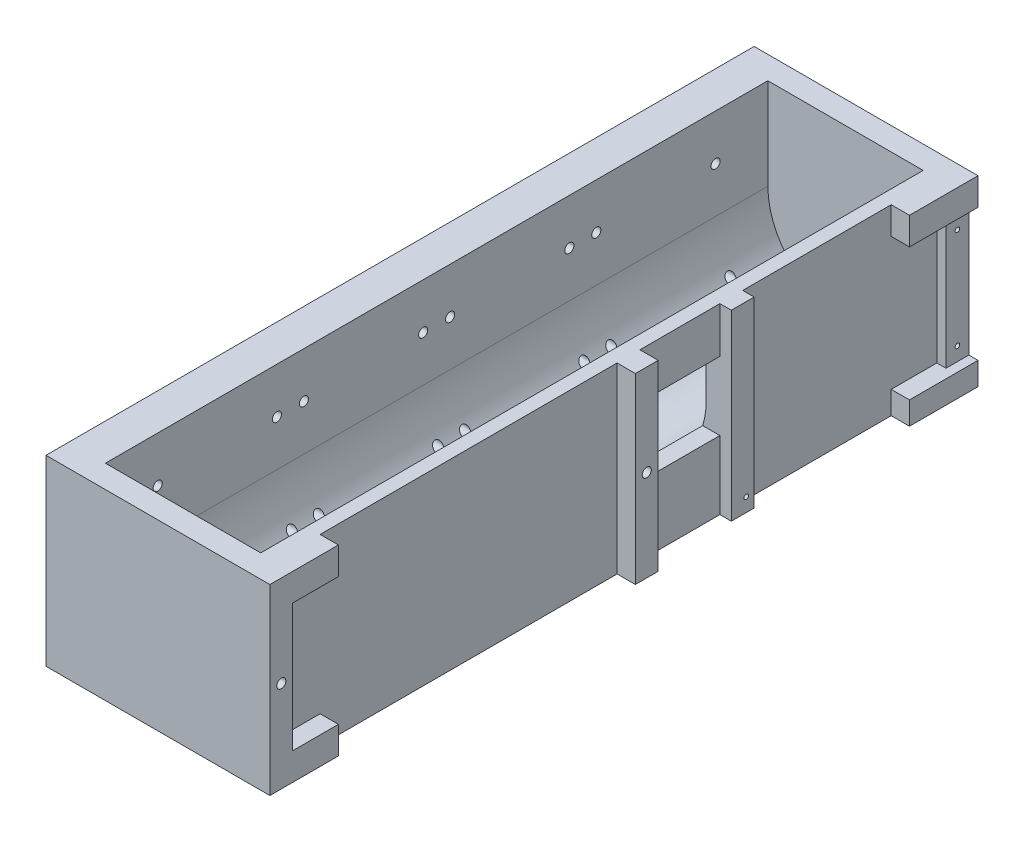
from build123d import *

# Parameters (mm, degrees)
SKETCH1_W            = 40
SKETCH1_H            = 40
BOSS_EXTRUDE1_DEPTH  = 155
SKETCH2_W            = 34
SKETCH2_H            = 145
CUT_EXTRUDE1_DEPTH   = 20
SKETCH3_R            = 17
CUT_EXTRUDE2_DEPTH   = 145
SKETCH4_W            = 155
SKETCH4_H            = 40
BOSS_EXTRUDE2_DEPTH  = 5
SKETCH5_R            = 1
CUT_EXTRUDE3_DEPTH   = 13
SKETCH6_W            = 5
SKETCH6_H            = 40
BOSS_EXTRUDE3_DEPTH  = 4
SKETCH7_W            = 5
SKETCH7_H            = 40
BOSS_EXTRUDE4_DEPTH  = 4
SKETCH8_W            = 5
SKETCH8_H            = 40
BOSS_EXTRUDE5_DEPTH  = 2
SKETCH9_W            = 5
SKETCH9_H            = 40
BOSS_EXTRUDE7_DEPTH  = 2.5
SKETCH12_R           = 0.5
CUT_EXTRUDE5_DEPTH   = 10
SKETCH13_R           = 0.5
CUT_EXTRUDE6_DEPTH   = 10
SKETCH14_R           = 1
CUT_EXTRUDE7_DEPTH   = 10
SKETCH15_R           = 1
CUT_EXTRUDE8_DEPTH   = 10
SKETCH16_W           = 17.5
SKETCH16_H           = 15
CUT_EXTRUDE9_DEPTH   = 10
SKETCH17_W           = 128
SKETCH17_H           = 2
BOSS_EXTRUDE8_DEPTH  = 2
SKETCH18_W           = 128
SKETCH18_H           = 2
BOSS_EXTRUDE9_DEPTH  = 2
SKETCH21_W           = 10
SKETCH21_H           = 6
BOSS_EXTRUDE10_DEPTH = 4
SKETCH22_W           = 10
SKETCH22_H           = 6
BOSS_EXTRUDE11_DEPTH = 4
SKETCH23_W           = 10
SKETCH23_H           = 6
BOSS_EXTRUDE12_DEPTH = 4
SKETCH24_W           = 2
SKETCH24_H           = 6
BOSS_EXTRUDE13_DEPTH = 5
SKETCH25_W           = 10
SKETCH25_H           = 5
BOSS_EXTRUDE16_DEPTH = 4
SKETCH27_W           = 2
SKETCH27_H           = 5
BOSS_EXTRUDE17_DEPTH = 5


with BuildPart() as part:
    # Sketch1 → Boss-Extrude1 (new body)
    with BuildSketch(Plane.XY):
        with Locations((4.210526316, -1.403508772)):
            Rectangle(SKETCH1_W, SKETCH1_H)
    extrude(amount=BOSS_EXTRUDE1_DEPTH)

    # Sketch2 → Cut-Extrude1 (cut)
    with BuildSketch(Plane(origin=(0, 18.596491228, 0), x_dir=(1, 0, 0), z_dir=(0, 1, 0))):
        with Locations((4.210526316, -77.5)):
            Rectangle(SKETCH2_W, SKETCH2_H)
    extrude(amount=-CUT_EXTRUDE1_DEPTH, mode=Mode.SUBTRACT)

    # Sketch3 → Cut-Extrude2 (cut)
    with BuildSketch(Plane.XY.offset(5)):
        with Locations((4.210526316, -1.403508772)):
            Circle(SKETCH3_R)
    extrude(amount=CUT_EXTRUDE2_DEPTH, mode=Mode.SUBTRACT)

    # Sketch4 → Boss-Extrude2 (add)
    with BuildSketch(Plane.ZY.offset(15.789473684)):
        with Locations((77.5, -1.403508772)):
            Rectangle(SKETCH4_W, SKETCH4_H)
    extrude(amount=BOSS_EXTRUDE2_DEPTH)

    # Sketch5 → Cut-Extrude3 (cut)
    with BuildSketch(Plane.ZY.offset(20.789473684)):
        with Locations((16.45, 8.596491228)):
            Circle(SKETCH5_R)
        with Locations((42.55, 8.596491228)):
            Circle(SKETCH5_R)
        with Locations((48.45, 8.596491228)):
            Circle(SKETCH5_R)
        with Locations((74.55, 8.596491228)):
            Circle(SKETCH5_R)
        with Locations((80.45, 8.596491228)):
            Circle(SKETCH5_R)
        with Locations((106.55, 8.596491228)):
            Circle(SKETCH5_R)
        with Locations((112.45, 8.596491228)):
            Circle(SKETCH5_R)
        with Locations((138.55, 8.596491228)):
            Circle(SKETCH5_R)
        with Locations((16.45, -11.453508772)):
            Circle(SKETCH5_R)
        with Locations((42.55, -11.453508772)):
            Circle(SKETCH5_R)
        with Locations((48.45, -11.453508772)):
            Circle(SKETCH5_R)
        with Locations((74.55, -11.453508772)):
            Circle(SKETCH5_R)
        with Locations((80.45, -11.453508772)):
            Circle(SKETCH5_R)
        with Locations((106.55, -11.453508772)):
            Circle(SKETCH5_R)
        with Locations((112.45, -11.453508772)):
            Circle(SKETCH5_R)
        with Locations((138.55, -11.453508772)):
            Circle(SKETCH5_R)
    extrude(amount=-CUT_EXTRUDE3_DEPTH, mode=Mode.SUBTRACT)

    # Sketch6 → Boss-Extrude3 (add)
    with BuildSketch(Plane(origin=(24.210526316, 0, 0), x_dir=(0, 0, -1), z_dir=(1, 0, 0))):
        with Locations((-152.5, -1.403508772)):
            Rectangle(SKETCH6_W, SKETCH6_H)
    extrude(amount=BOSS_EXTRUDE3_DEPTH)

    # Sketch7 → Boss-Extrude4 (add)
    with BuildSketch(Plane(origin=(24.210526316, 0, 0), x_dir=(0, 0, -1), z_dir=(1, 0, 0))):
        with Locations((-72.5, -1.403508772)):
            Rectangle(SKETCH7_W, SKETCH7_H)
    extrude(amount=BOSS_EXTRUDE4_DEPTH)

    # Sketch8 → Boss-Extrude5 (add)
    with BuildSketch(Plane(origin=(24.210526316, 0, 0), x_dir=(0, 0, -1), z_dir=(1, 0, 0))):
        with Locations((-2.5, -1.403508772)):
            Rectangle(SKETCH8_W, SKETCH8_H)
    extrude(amount=BOSS_EXTRUDE5_DEPTH)

    # Sketch9 → Boss-Extrude7 (add)
    with BuildSketch(Plane(origin=(24.210526316, 0, 0), x_dir=(0, 0, -1), z_dir=(1, 0, 0))):
        with Locations((-50, -1.403508772)):
            Rectangle(SKETCH9_W, SKETCH9_H)
    extrude(amount=BOSS_EXTRUDE7_DEPTH)

    # Sketch12 → Cut-Extrude5 (cut)
    with BuildSketch(Plane(origin=(26.210526316, 0, 0), x_dir=(0, 0, -1), z_dir=(1, 0, 0))):
        with Locations(Location((-2.5, 8.596491228, 0), (0, 0, 90))):
            Circle(SKETCH12_R)
        with Locations(Location((-2.5, -13.403508772, 0), (0, 0, 90))):
            Circle(SKETCH12_R)
    extrude(amount=-CUT_EXTRUDE5_DEPTH, mode=Mode.SUBTRACT)

    # Sketch13 → Cut-Extrude6 (cut)
    with BuildSketch(Plane(origin=(26.710526316, 0, 0), x_dir=(0, 0, -1), z_dir=(1, 0, 0))):
        with Locations(Location((-49.233285782, -18.403508772, 0), (0, 0, 90))):
            Circle(SKETCH13_R)
    extrude(amount=-CUT_EXTRUDE6_DEPTH, mode=Mode.SUBTRACT)

    # Sketch14 → Cut-Extrude7 (cut)
    with BuildSketch(Plane(origin=(28.210526316, 0, 0), x_dir=(0, 0, -1), z_dir=(1, 0, 0))):
        with Locations(Location((-72.5, -1.403508772, 0), (0, 0, 90))):
            Circle(SKETCH14_R)
    extrude(amount=-CUT_EXTRUDE7_DEPTH, mode=Mode.SUBTRACT)

    # Sketch15 → Cut-Extrude8 (cut)
    with BuildSketch(Plane(origin=(28.210526316, 0, 0), x_dir=(0, 0, -1), z_dir=(1, 0, 0))):
        with Locations(Location((-152.5, -1.403508772, 0), (0, 0, 90))):
            Circle(SKETCH15_R)
    extrude(amount=-CUT_EXTRUDE8_DEPTH, mode=Mode.SUBTRACT)

    # Sketch16 → Cut-Extrude9 (cut)
    with BuildSketch(Plane(origin=(24.210526316, 0, 0), x_dir=(0, 0, -1), z_dir=(1, 0, 0))):
        with Locations((-61.25, 1.096491228)):
            Rectangle(SKETCH16_W, SKETCH16_H)
    extrude(amount=-CUT_EXTRUDE9_DEPTH, mode=Mode.SUBTRACT)

    # Sketch17 → Boss-Extrude8 (add)
    with BuildSketch(Plane.ZY.offset(20.789473684)):
        with Locations((77.5, 12.596491228)):
            Rectangle(SKETCH17_W, SKETCH17_H)
    extrude(amount=BOSS_EXTRUDE8_DEPTH)

    # Sketch21 → Boss-Extrude10 (add)
    with BuildSketch(Plane(origin=(24.210526316, 0, 0), x_dir=(0, 0, -1), z_dir=(1, 0, 0))):
        with Locations((-145, 15.596491228)):
            Rectangle(SKETCH21_W, SKETCH21_H)
    extrude(amount=BOSS_EXTRUDE10_DEPTH)

    # Sketch22 → Boss-Extrude11 (add)
    with BuildSketch(Plane(origin=(24.210526316, 0, 0), x_dir=(0, 0, -1), z_dir=(1, 0, 0))):
        with Locations((-145, -18.403508772)):
            Rectangle(SKETCH22_W, SKETCH22_H)
    extrude(amount=BOSS_EXTRUDE11_DEPTH)

    # Sketch23 → Boss-Extrude12 (add)
    with BuildSketch(Plane(origin=(24.210526316, 0, 0), x_dir=(0, 0, -1), z_dir=(1, 0, 0))):
        with Locations((-10, 15.596491228)):
            Rectangle(SKETCH23_W, SKETCH23_H)
    extrude(amount=BOSS_EXTRUDE12_DEPTH)

    # Sketch24 → Boss-Extrude13 (add)
    with BuildSketch(Plane(origin=(0, 0, 5), x_dir=(-1, 0, 0), z_dir=(0, 0, -1))):
        with Locations((-27.210526316, 15.596491228)):
            Rectangle(SKETCH24_W, SKETCH24_H)
    extrude(amount=BOSS_EXTRUDE13_DEPTH)

    # Sketch25 → Boss-Extrude16 (add)
    with BuildSketch(Plane(origin=(24.210526316, 0, 0), x_dir=(0, 0, -1), z_dir=(1, 0, 0))):
        with Locations((-10, -18.903508772)):
            Rectangle(SKETCH25_W, SKETCH25_H)
    extrude(amount=BOSS_EXTRUDE16_DEPTH)

    # Sketch27 → Boss-Extrude17 (add)
    with BuildSketch(Plane(origin=(0, 0, 5), x_dir=(-1, 0, 0), z_dir=(0, 0, -1))):
        with Locations((-27.210526316, -18.903508772)):
            Rectangle(SKETCH27_W, SKETCH27_H)
    extrude(amount=BOSS_EXTRUDE17_DEPTH)


with BuildPart() as body_2:
    # Sketch18 → Boss-Extrude9 (new body)
    with BuildSketch(Plane.ZY.offset(22.789473684)):
        with Locations((77.5, -15.453508772)):
            Rectangle(SKETCH18_W, SKETCH18_H)
    extrude(amount=BOSS_EXTRUDE9_DEPTH)


solid = Compound([part.part, body_2.part])
